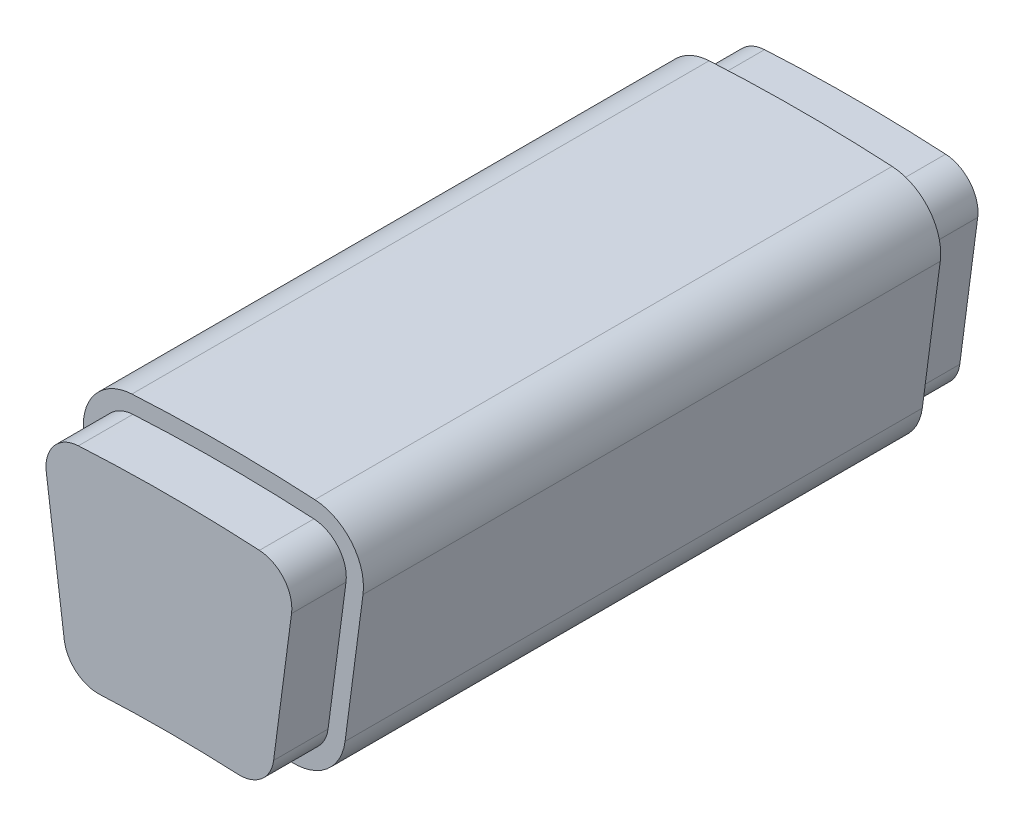
from build123d import *

# Parameters (mm, degrees)
BOSS_EXTRUDE1_DEPTH      = 36.825
BOSS_EXTRUDE1_DEPTH_BACK = 3.175
BOSS_EXTRUDE2_DEPTH      = 33.65


with BuildPart() as part:
    # Sketch1 → Boss-Extrude1 (new, two sides: drawn at the far end of the back side and taken through both)
    with BuildSketch(Plane.XY.offset(-BOSS_EXTRUDE1_DEPTH_BACK)):
        with BuildLine():
            Line((6.103170523, 84.664670477), (7.148138473, 92.601990083))
            ThreePointArc((7.148138473, 92.601990083), (6.704979898, 94.139454624), (5.276321506, 94.859955796))
            ThreePointArc((5.276321506, 94.859955796), (0, 95.006582836), (-5.276321506, 94.859955796))
            ThreePointArc((-5.276321506, 94.859955796), (-6.704979898, 94.139454624), (-7.148138473, 92.601990083))
            Line((-7.148138473, 92.601990083), (-6.103170523, 84.664670477))
            ThreePointArc((-6.103170523, 84.664670477), (-5.402140732, 83.39052414), (-4.023362223, 82.928072545))
            ThreePointArc((-4.023362223, 82.928072545), (0, 83.025614479), (4.023362223, 82.928072545))
            ThreePointArc((4.023362223, 82.928072545), (5.402140732, 83.39052414), (6.103170523, 84.664670477))
        make_face()
    extrude(amount=BOSS_EXTRUDE1_DEPTH + BOSS_EXTRUDE1_DEPTH_BACK)

    # Sketch2 → Boss-Extrude2 (add)
    with BuildSketch(Plane.XY):
        with BuildLine():
            Line((7.094615384, 84.534144285), (8.139583334, 92.47146389))
            ThreePointArc((8.139583334, 92.47146389), (7.474845471, 94.777660702), (5.331857885, 95.85841246))
            ThreePointArc((5.331857885, 95.85841246), (0, 96.006582836), (-5.331857885, 95.85841246))
            ThreePointArc((-5.331857885, 95.85841246), (-7.474845471, 94.777660702), (-8.139583334, 92.47146389))
            Line((-8.139583334, 92.47146389), (-7.094615384, 84.534144285))
            ThreePointArc((-7.094615384, 84.534144285), (-6.043070698, 82.622924779), (-3.974902934, 81.929247386))
            ThreePointArc((-3.974902934, 81.929247386), (0, 82.025614479), (3.974902934, 81.929247386))
            ThreePointArc((3.974902934, 81.929247386), (6.043070698, 82.622924779), (7.094615384, 84.534144285))
        make_face()
    extrude(amount=BOSS_EXTRUDE2_DEPTH)


solid = part.part
